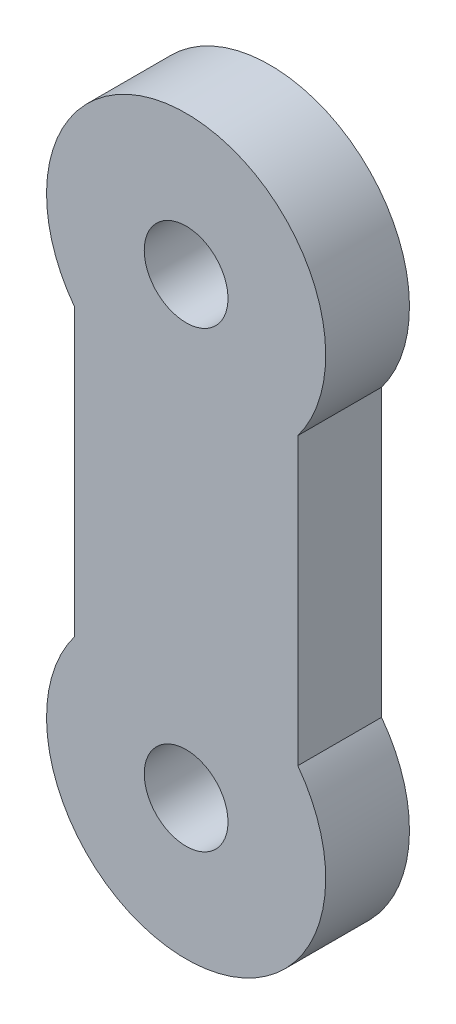
from build123d import *

# Parameters (mm, degrees)
EXTRUDE_1_DEPTH     = 3
SKETCH_2_R          = 1.5
CUT_EXTRUDE_1_DEPTH = 15.357381377


with BuildPart() as part:
    # 草图1 → 凸台-拉伸1 (new body)
    with BuildSketch(Plane.XY):
        with BuildLine():
            ThreePointArc((-4, 5.12), (0, 3.12), (4, 5.12))
            Line((4, 5.12), (4, 8.12))
            Line((4, 8.12), (-4, 8.12))
            Line((-4, 8.12), (-4, 5.12))
        make_face()
        with BuildLine():
            Line((4, 8.12), (4, 5.12))
            ThreePointArc((4, 5.12), (4.74341649, 6.53886117), (5, 8.12))
            ThreePointArc((5, 8.12), (-1.58113883, 12.86341649), (-4, 5.12))
            Line((-4, 5.12), (-4, 8.12))
            Line((-4, 8.12), (4, 8.12))
        make_face()
        with BuildLine():
            ThreePointArc((-4, -5.12), (0, -3.12), (4, -5.12))
            Line((4, -5.12), (4, 5.12))
            ThreePointArc((4, 5.12), (0, 3.12), (-4, 5.12))
            Line((-4, 5.12), (-4, -5.12))
        make_face()
        with BuildLine():
            Line((4, -5.12), (4, -8.12))
            Line((4, -8.12), (-4, -8.12))
            Line((-4, -8.12), (-4, -5.12))
            ThreePointArc((-4, -5.12), (-1.58113883, -12.86341649), (5, -8.12))
            ThreePointArc((5, -8.12), (4.74341649, -6.53886117), (4, -5.12))
        make_face()
        with BuildLine():
            Line((-4, -8.12), (4, -8.12))
            Line((4, -8.12), (4, -5.12))
            ThreePointArc((4, -5.12), (0, -3.12), (-4, -5.12))
            Line((-4, -5.12), (-4, -8.12))
        make_face()
    extrude(amount=EXTRUDE_1_DEPTH)

    # 草图2 → 切除-拉伸1 (cut, through all)
    with BuildSketch(Plane(origin=(0, 0, 0), x_dir=(-1, 0, 0), z_dir=(0, 0, -1))):
        with Locations((0, 8.12)):
            Circle(SKETCH_2_R)
        with Locations(Location((0, -8.12, 0), (0, 0, 180))):
            Circle(SKETCH_2_R)
    extrude(amount=-CUT_EXTRUDE_1_DEPTH, mode=Mode.SUBTRACT)


solid = part.part
